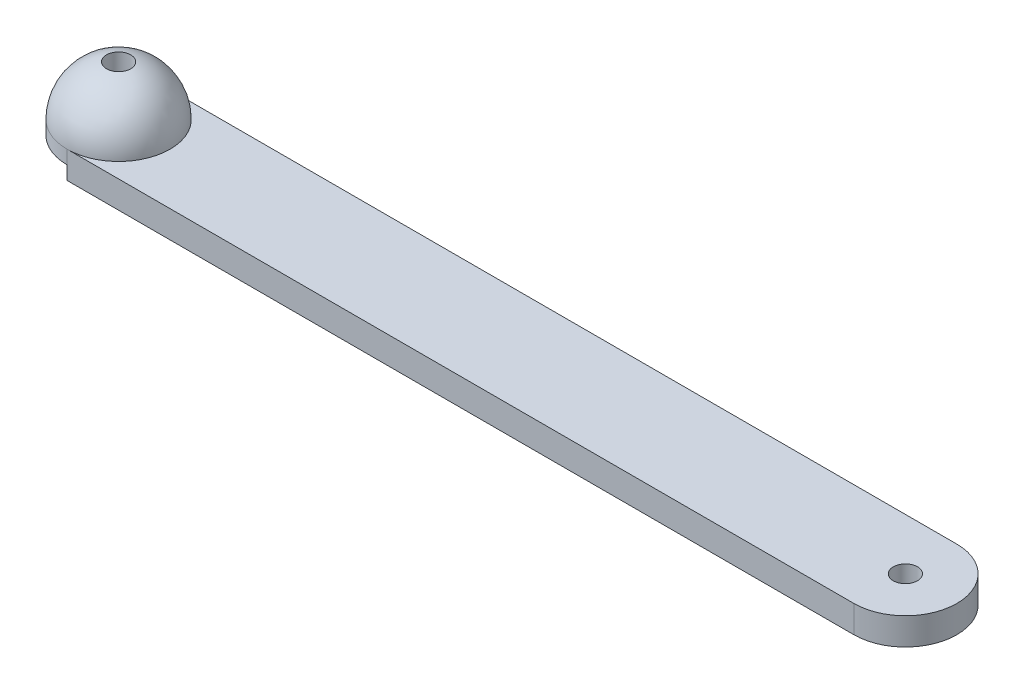
from build123d import *

# Parameters (mm, degrees)
BOSS_EXTRU_1_DEPTH      = 8
ESQUISSE2_R             = 7.15
ENL_V_MAT_EXTRU_1_DEPTH = 265.732643435
R_VOLUTION1_ANGLE       = 180
ESQUISSE4_R             = 7.15
ENL_V_MAT_EXTRU_2_DEPTH = 269.282863784
ESQUISSE5_R             = 30.35
ENL_V_MAT_EXTRU_6_DEPTH = 8


with BuildPart() as part:
    # Esquisse1 → Boss.-Extru.1 (new, symmetric)
    with BuildSketch(Plane(origin=(0, 0, 0), x_dir=(1, 0, 0), z_dir=(0, 1, 0))):
        with BuildLine():
            Line((-232.15, 30.35), (232.15, 30.35))
            ThreePointArc((232.15, 30.35), (262.5, 0), (232.15, -30.35))
            Line((232.15, -30.35), (-232.15, -30.35))
            ThreePointArc((-232.15, -30.35), (-262.5, 0), (-232.15, 30.35))
        make_face()
    extrude(amount=BOSS_EXTRU_1_DEPTH, both=True)

    # Esquisse2 → Enlèv. mat.-Extru.1 (cut, through all)
    with BuildSketch(Plane(origin=(0, 8, 0), x_dir=(1, 0, 0), z_dir=(0, 1, 0))):
        with Locations(Location((232.15, 0, 0), (0, 0, 270))):
            Circle(ESQUISSE2_R)
    extrude(amount=-ENL_V_MAT_EXTRU_1_DEPTH, mode=Mode.SUBTRACT)

    # Esquisse3 → Révolution1 (revolve)
    with BuildSketch(Plane(origin=(0, 8, 0), x_dir=(1, 0, 0), z_dir=(0, 1, 0))):
        with BuildLine():
            Line((-232.15, 30.35), (-232.15, -30.35))
            ThreePointArc((-232.15, -30.35), (-262.5, 0), (-232.15, 30.35))
        make_face()
    revolve(axis=Axis((-232.15, 8, -30.35), (0, 0, -1)), revolution_arc=R_VOLUTION1_ANGLE)

    # Esquisse4 → Enlèv. mat.-Extru.2 (cut, through all)
    with BuildSketch(Plane.XZ.offset(8)):
        with Locations(Location((-232.15, 0, 0), (0, 0, 270))):
            Circle(ESQUISSE4_R)
    extrude(amount=-ENL_V_MAT_EXTRU_2_DEPTH, mode=Mode.SUBTRACT)

    # Esquisse5 → Enlèv. mat.-Extru.6 (cut)
    with BuildSketch(Plane(origin=(0, 0, 0), x_dir=(1, 0, 0), z_dir=(0, 1, 0))):
        with Locations((-232.15, 0)):
            Circle(ESQUISSE5_R)
    extrude(amount=-ENL_V_MAT_EXTRU_6_DEPTH, mode=Mode.SUBTRACT)


solid = part.part
